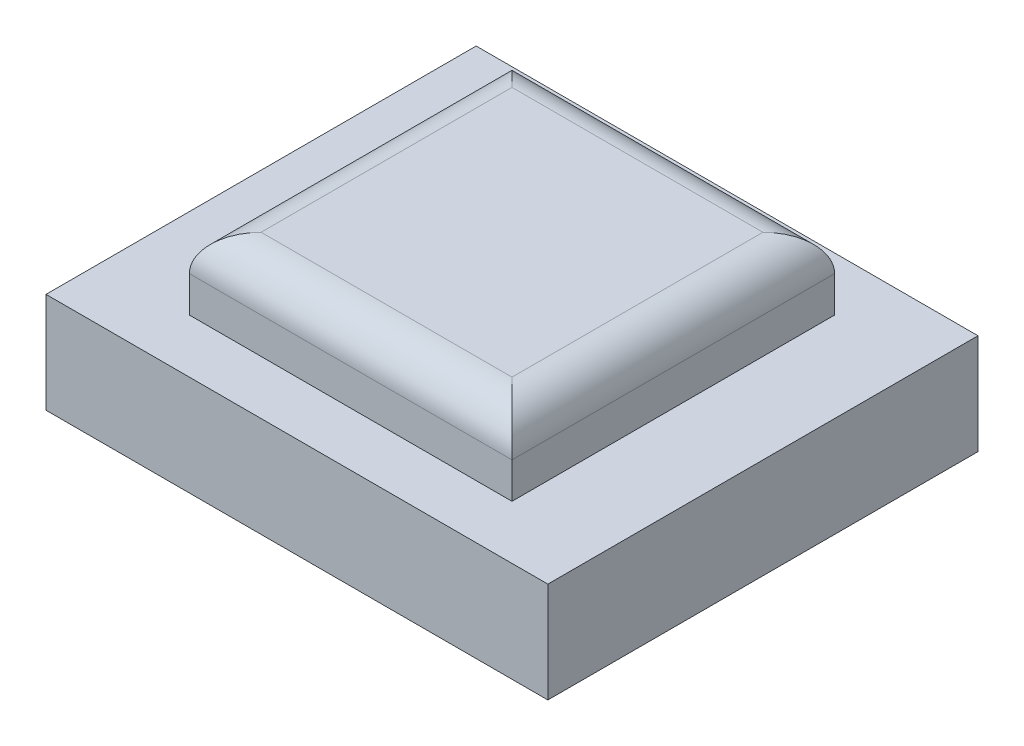
from build123d import *

# Parameters (mm, degrees)
SKETCH1_W           = 3.5
SKETCH1_H           = 3
BOSS_EXTRUDE1_DEPTH = 0.7
SKETCH2_W           = 2.25
SKETCH2_H           = 2.25
BOSS_EXTRUDE2_DEPTH = 0.5
FILLET1_R           = 0.25


with BuildPart() as part:
    # Sketch1 → Boss-Extrude1 (new body)
    with BuildSketch(Plane(origin=(0, 0, 0), x_dir=(1, 0, 0), z_dir=(0, 1, 0))):
        Rectangle(SKETCH1_W, SKETCH1_H)
    extrude(amount=BOSS_EXTRUDE1_DEPTH)

    # Sketch2 → Boss-Extrude2 (add)
    with BuildSketch(Plane(origin=(0, 0.7, 0), x_dir=(1, 0, 0), z_dir=(0, 1, 0))):
        Rectangle(SKETCH2_W, SKETCH2_H)
    extrude(amount=BOSS_EXTRUDE2_DEPTH)

    # Fillet1
    fillet1_edges = [part.edges().sort_by_distance(p)[0] for p in [
        (0, 1.2, -1.125),
        (1.125, 1.2, 0),
        (-1.125, 1.2, 0),
        (0, 1.2, 1.125),
    ]]
    fillet(fillet1_edges, radius=FILLET1_R)


solid = part.part
